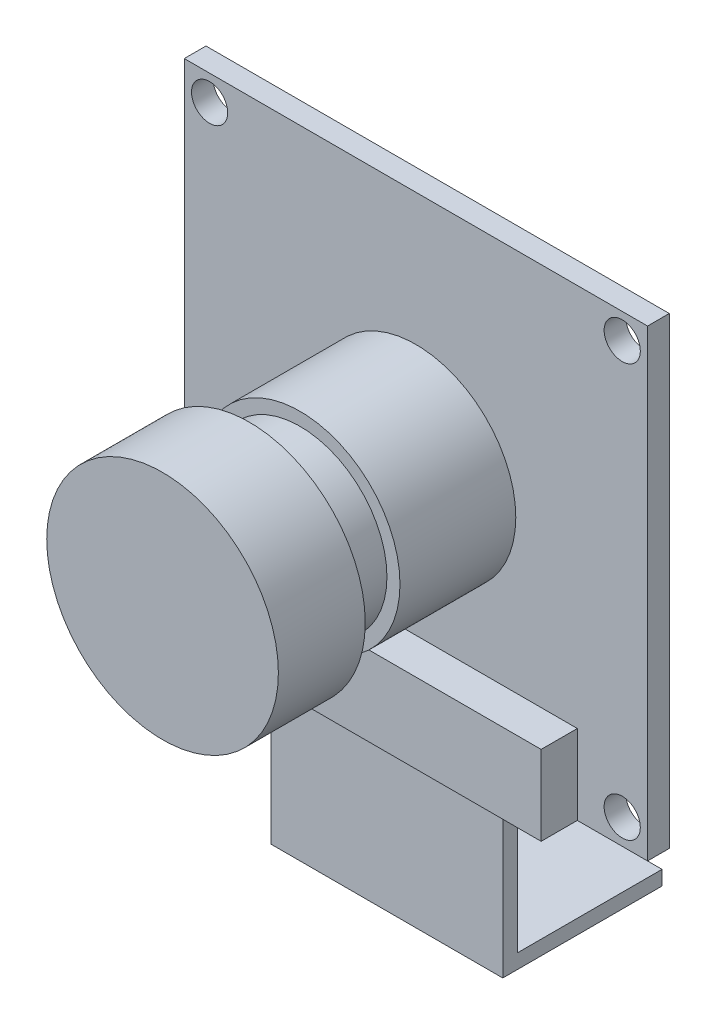
from build123d import *

# Parameters (mm, degrees)
SKETCH_1_W         = 32
SKETCH_1_H         = 32
SKETCH_1_R         = 1.25
EXTRUDE_1472_DEPTH = 1.5
EXTRUDE_START      = 1.5
SKETCH_1_3_W       = 22.3
SKETCH_1_3_H       = 5.5
EXTRUDE_1647_DEPTH = 2.5
SKETCH_1_4_R       = 6.9
SKETCH_1_4_R_2     = 6
EXTRUDE_1817_DEPTH = 8
EXTRUDE_START_2    = 9.5
SKETCH_1_5_R       = 6
EXTRUDE_1989_DEPTH = 3.5
EXTRUDE_START_3    = 13
SKETCH_1_6_R       = 8
SKETCH_1_6_R_2     = 6.9
SKETCH_1_6_R_3     = 6
EXTRUDE_2083_DEPTH = 6
SKETCH_1_7_R       = 1.5
EXTRUDE_2264_DEPTH = 0.5
SKETCH_2_W         = 16
SKETCH_2_H         = 1
EXTRUDE_2724_DEPTH = 10
SKETCH_3_W         = 16
SKETCH_3_H         = 1
EXTRUDE_3021_DEPTH = 10


with BuildPart() as part:
    # Эскиз1 → Extrude 1472 (new body)
    with BuildSketch(Plane.XY):
        Rectangle(SKETCH_1_W, SKETCH_1_H)
        with Locations((-14.25, -14.25)):
            Circle(SKETCH_1_R, mode=Mode.SUBTRACT)
        with Locations((14.25, -14.25)):
            Circle(SKETCH_1_R, mode=Mode.SUBTRACT)
        with Locations((-14.25, 14.25)):
            Circle(SKETCH_1_R, mode=Mode.SUBTRACT)
        with Locations((14.25, 14.25)):
            Circle(SKETCH_1_R, mode=Mode.SUBTRACT)
    extrude(amount=EXTRUDE_1472_DEPTH)

    # Эскиз1<3> → Extrude 1647 (add)
    with BuildSketch(Plane.XY.offset(EXTRUDE_START)):
        with Locations((0, -13.25)):
            Rectangle(SKETCH_1_3_W, SKETCH_1_3_H)
    extrude(amount=EXTRUDE_1647_DEPTH)

    # Эскиз1<4> → Extrude 1817 (add)
    # profile 1 of 2: a face of its own
    with BuildSketch(Plane.XY.offset(EXTRUDE_START)):
        Circle(SKETCH_1_4_R)
        Circle(SKETCH_1_4_R_2, mode=Mode.SUBTRACT)
    # profile 2 of 2: a face of its own
    with BuildSketch(Plane.XY.offset(EXTRUDE_START)):
        Circle(SKETCH_1_4_R_2)
    extrude(amount=EXTRUDE_1817_DEPTH)

    # Эскиз1<5> → Extrude 1989 (add)
    with BuildSketch(Plane.XY.offset(EXTRUDE_START_2)):
        Circle(SKETCH_1_5_R)
    extrude(amount=EXTRUDE_1989_DEPTH)

    # Эскиз1<6> → Extrude 2083 (add)
    # profile 1 of 3: a face of its own
    with BuildSketch(Plane.XY.offset(EXTRUDE_START_3)):
        Circle(SKETCH_1_6_R)
        Circle(SKETCH_1_6_R_2, mode=Mode.SUBTRACT)
    # profile 2 of 3: a face of its own
    with BuildSketch(Plane.XY.offset(EXTRUDE_START_3)):
        Circle(SKETCH_1_6_R_2)
        Circle(SKETCH_1_6_R_3, mode=Mode.SUBTRACT)
    # profile 3 of 3: a face of its own
    with BuildSketch(Plane.XY.offset(EXTRUDE_START_3)):
        Circle(SKETCH_1_6_R_3)
    extrude(amount=EXTRUDE_2083_DEPTH)

    # Эскиз1<7> → Extrude 2264 (add)
    with BuildSketch(Plane.XY):
        with Locations((9.5, 0)):
            Circle(SKETCH_1_7_R)
        with Locations((-9.5, 0)):
            Circle(SKETCH_1_7_R)
    extrude(amount=-EXTRUDE_2264_DEPTH)

    # Эскиз2 → Extrude 2724 (add)
    with BuildSketch(Plane.XZ.offset(16)):
        with Locations((0, 3)):
            Rectangle(SKETCH_2_W, SKETCH_2_H)
    extrude(amount=EXTRUDE_2724_DEPTH)

    # Эскиз3 → Extrude 3021 (add)
    with BuildSketch(Plane(origin=(0, 0, 2.5), x_dir=(-1, 0, 0), z_dir=(0, 0, -1))):
        with Locations((0, -25.5)):
            Rectangle(SKETCH_3_W, SKETCH_3_H)
    extrude(amount=EXTRUDE_3021_DEPTH)


solid = part.part
